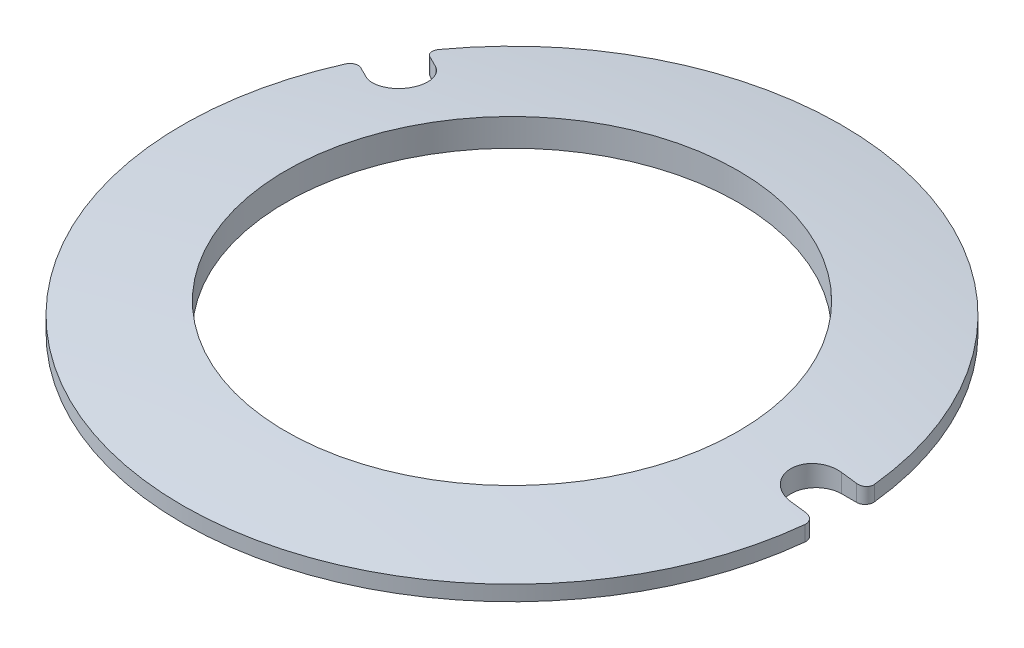
from build123d import *

# Parameters (mm, degrees)
CUT_EXTRUDE2_DEPTH = 283.892205619
FILLET1_R          = 1


with BuildPart() as part:
    # Sketch1 → Revolve1 (revolve)
    with BuildSketch(Plane.XY, mode=Mode.PRIVATE) as revolve1_sk:
        with BuildLine():
            Line((39, 274.208265275), (26.75, 274.208265275))
            Line((26.75, 274.208265275), (26.75, 277.463511115))
            ThreePointArc((26.75, 277.463511115), (32.883051259, 276.803662259), (39, 276.008265275))
            Line((39, 276.008265275), (39, 274.208265275))
        make_face()
    revolve(revolve1_sk.sketch.rotate(Axis((0, 0, 0), (0, 1, 0)), 90), axis=Axis((0, 0, 0), (0, 1, 0)))

    # Sketch2 → Cut-Extrude2 (cut, through all)
    with BuildSketch(Plane(origin=(0, 0, 0), x_dir=(1, 0, 0), z_dir=(0, 1, 0))):
        with BuildLine():
            Line((36, 3), (46, 3))
            ThreePointArc((46, 3), (49, 0), (46, -3))
            Line((46, -3), (36, -3))
            ThreePointArc((36, -3), (33, 0), (36, 3))
        make_face()
        with BuildLine():
            Line((-32.676914536, 15.401923789), (-41.337168574, 20.401923789))
            ThreePointArc((-41.337168574, 20.401923789), (-42.435244785, 24.5), (-38.337168574, 25.598076211))
            Line((-38.337168574, 25.598076211), (-29.676914536, 20.598076211))
            ThreePointArc((-29.676914536, 20.598076211), (-28.578838325, 16.5), (-32.676914536, 15.401923789))
        make_face()
    extrude(amount=CUT_EXTRUDE2_DEPTH, mode=Mode.SUBTRACT)

    # Fillet1
    fillet1_edges = [part.edges().sort_by_distance(p)[0] for p in [
        (38.88444419, 275.108265275, 3),
        (38.88444419, 275.108265275, -3),
        (-32.174916481, 275.108265275, -22.040298307),
        (-35.174916481, 275.108265275, -16.844145884),
    ]]
    fillet(fillet1_edges, radius=FILLET1_R)


solid = part.part
